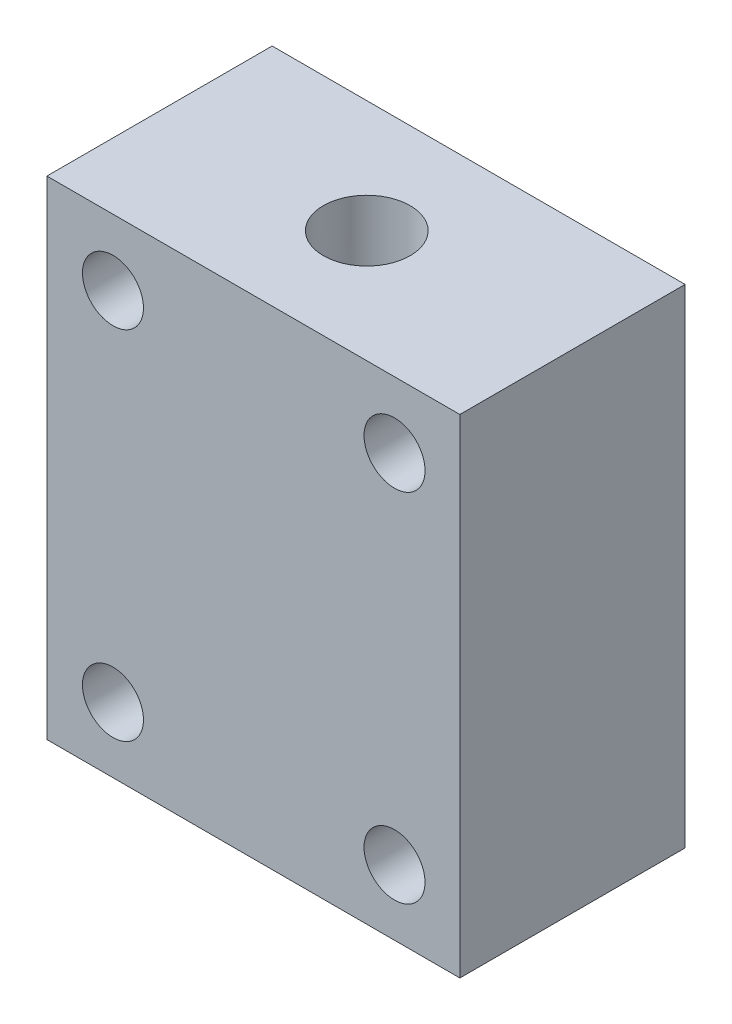
from build123d import *

# Parameters (mm, degrees)
SKETCH1_W                   = 82.55
SKETCH1_H                   = 69.85
BOSS_EXTRUDE1_DEPTH         = 19.05
F_3_8_CLEARANCE_HOLE1_D     = 10.31875
F_3_8_CLEARANCE_HOLE1_DEPTH = 38.1
F_3_8_CLEARANCE_HOLE1_TIP   = 3.100065256
CUT_EXTRUDE2_START          = -19.05
SKETCH4_R                   = 7.3421875
CUT_EXTRUDE2_DEPTH          = 28.448
CUT_EXTRUDE4_START          = -19.05
SKETCH5_R                   = 12.7254
CUT_EXTRUDE4_DEPTH          = 2.8194
CUT_EXTRUDE6_START          = 41.275
SKETCH6_R                   = 7.3421875
CUT_EXTRUDE6_DEPTH          = 60.452


with BuildPart() as part:
    # Sketch1 → Boss-Extrude1 (new, symmetric)
    with BuildSketch(Plane(origin=(0, 0, 0), x_dir=(0, 1, 0), z_dir=(0, 0, 1))):
        Rectangle(SKETCH1_W, SKETCH1_H)
    extrude(amount=BOSS_EXTRUDE1_DEPTH, both=True)

    # 3/8 Clearance Hole1
    with Locations(Plane(origin=(0, 0, -19.05), x_dir=(-1, 0, 0), z_dir=(0, 0, -1))):
        with Locations((-23.876, -30.226), (-23.876, 30.099), (23.749, -30.226), (23.749, 30.099)):
            Hole(F_3_8_CLEARANCE_HOLE1_D / 2, depth=F_3_8_CLEARANCE_HOLE1_DEPTH)
            with Locations((0, 0, -(F_3_8_CLEARANCE_HOLE1_DEPTH + F_3_8_CLEARANCE_HOLE1_TIP / 2))):  # 118° drill point
                Cone(0, F_3_8_CLEARANCE_HOLE1_D / 2, F_3_8_CLEARANCE_HOLE1_TIP, mode=Mode.SUBTRACT)

    # Sketch4 → Cut-Extrude2 (cut)
    with BuildSketch(Plane(origin=(0, 0, 0), x_dir=(0, 1, 0), z_dir=(0, 0, 1)).offset(CUT_EXTRUDE2_START)):
        with Locations(Location((-17.653, -0.127, 0), (0, 0, 270))):
            Circle(SKETCH4_R)
        with Locations(Location((17.399, -0.127, 0), (0, 0, 270))):
            Circle(SKETCH4_R)
    extrude(amount=CUT_EXTRUDE2_DEPTH, mode=Mode.SUBTRACT)

    # Sketch5 → Cut-Extrude4 (cut)
    with BuildSketch(Plane(origin=(0, 0, 0), x_dir=(0, 1, 0), z_dir=(0, 0, 1)).offset(CUT_EXTRUDE4_START)):
        with Locations(Location((-17.653, -0.127, 0), (0, 0, 270))):
            Circle(SKETCH5_R)
        with Locations(Location((17.399, -0.127, 0), (0, 0, 270))):
            Circle(SKETCH5_R)
    extrude(amount=CUT_EXTRUDE4_DEPTH, mode=Mode.SUBTRACT)

    # Sketch6 → Cut-Extrude6 (cut)
    with BuildSketch(Plane(origin=(0, 0, 0), x_dir=(-1, 0, 0), z_dir=(0, 1, 0)).offset(CUT_EXTRUDE6_START)):
        with Locations((-0.127, 0)):
            Circle(SKETCH6_R)
    extrude(amount=-CUT_EXTRUDE6_DEPTH, mode=Mode.SUBTRACT)


solid = part.part
